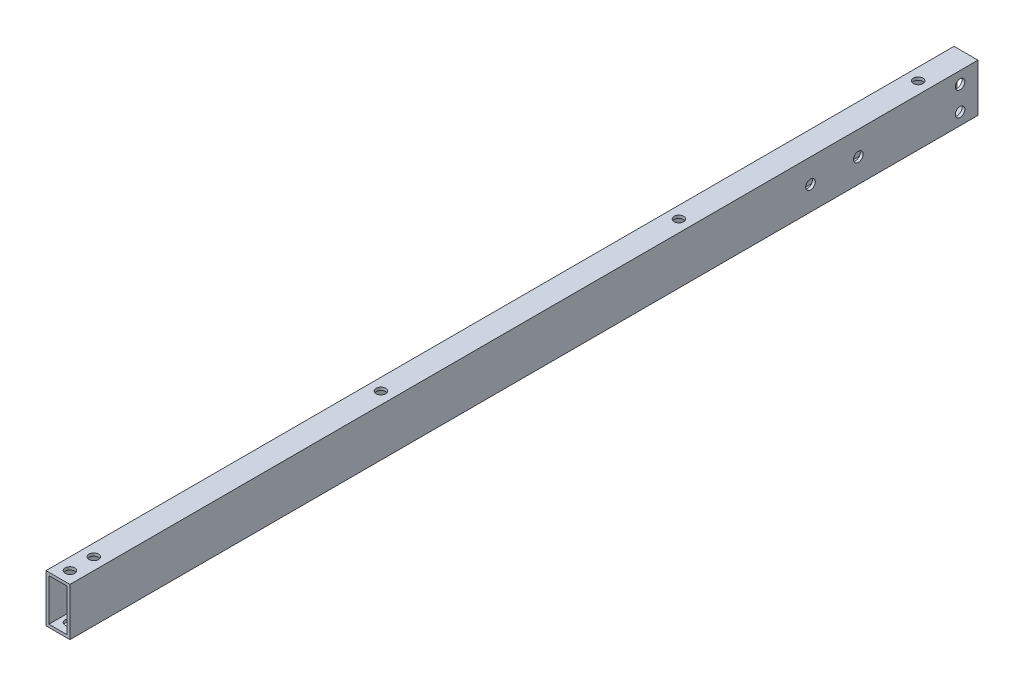
from build123d import *

# Parameters (mm, degrees)
SKETCH_1_W          = 10
SKETCH_1_H          = 20
SKETCH_1_W_2        = 7.6
SKETCH_1_H_2        = 17.6
EXTRUDE_1_DEPTH     = 379.5
SKETCH_2_R          = 2
CUT_EXTRUDE_1_DEPTH = 381.05953481
SKETCH_3_R          = 2
CUT_EXTRUDE_2_DEPTH = 380.763413193


with BuildPart() as part:
    # ｽｹｯﾁ1 → 押し出し-薄板1 (new body)
    with BuildSketch(Plane.XY):
        Rectangle(SKETCH_1_W, SKETCH_1_H)
        Rectangle(SKETCH_1_W_2, SKETCH_1_H_2, mode=Mode.SUBTRACT)
    extrude(amount=EXTRUDE_1_DEPTH)

    # ｽｹｯﾁ2 → ｶｯﾄ - 押し出し1 (cut, through all)
    with BuildSketch(Plane(origin=(0, 10, 0), x_dir=(1, 0, 0), z_dir=(0, 1, 0))):
        with Locations(Location((0, -364.5, 0), (0, 0, 270))):
            Circle(SKETCH_2_R)
        with Locations(Location((0, -374.5, 0), (0, 0, 270))):
            Circle(SKETCH_2_R)
        with Locations(Location((0, -244.5, 0), (0, 0, 270))):
            Circle(SKETCH_2_R)
        with Locations(Location((0, -120, 0), (0, 0, 270))):
            Circle(SKETCH_2_R)
        with Locations(Location((0, -20, 0), (0, 0, 270))):
            Circle(SKETCH_2_R)
    extrude(amount=-CUT_EXTRUDE_1_DEPTH, mode=Mode.SUBTRACT)

    # ｽｹｯﾁ3 → ｶｯﾄ - 押し出し2 (cut, through all)
    with BuildSketch(Plane(origin=(5, 0, 0), x_dir=(0, 0, -1), z_dir=(1, 0, 0))):
        with Locations(Location((-7.5, 5, 0), (0, 0, 90))):
            Circle(SKETCH_3_R)
        with Locations(Location((-7.5, -5, 0), (0, 0, 90))):
            Circle(SKETCH_3_R)
        with Locations(Location((-70, 0, 0), (0, 0, 90))):
            Circle(SKETCH_3_R)
        with Locations(Location((-50, 0, 0), (0, 0, 90))):
            Circle(SKETCH_3_R)
    extrude(amount=-CUT_EXTRUDE_2_DEPTH, mode=Mode.SUBTRACT)


solid = part.part
